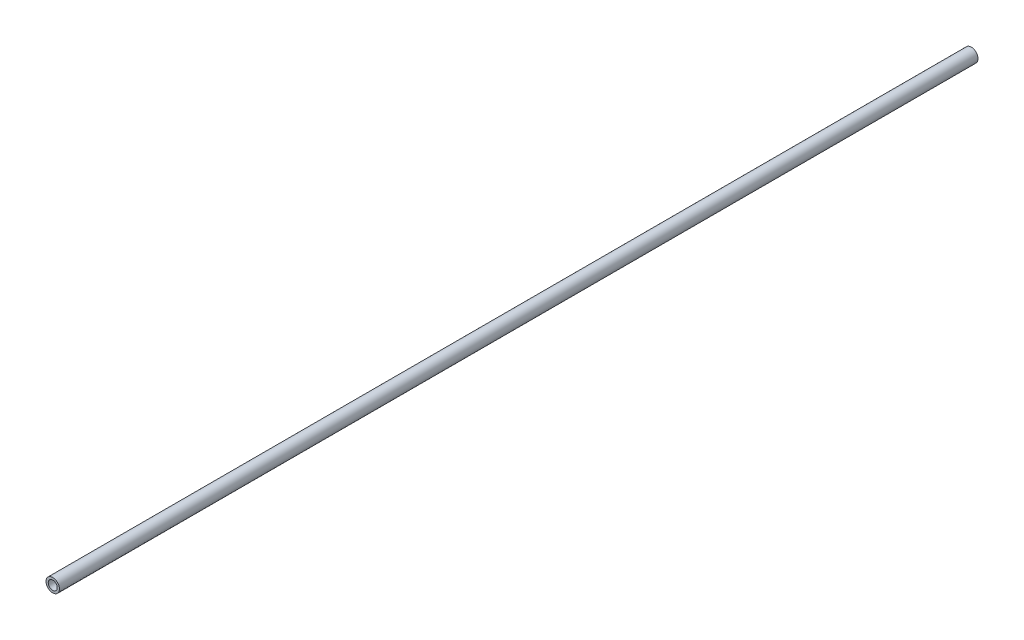
from build123d import *

# Parameters (mm, degrees)
SKETCH_1_R      = 3
SKETCH_1_R_2    = 2
EXTRUDE_1_DEPTH = 205


with BuildPart() as part:
    # Эскиз1 → Бобышка-Вытянуть1 (new, symmetric)
    with BuildSketch(Plane.XY):
        with Locations(Location((0, 0, 0), (0, 0, 180))):
            Circle(SKETCH_1_R)
        with Locations(Location((0, 0, 0), (0, 0, 180))):
            Circle(SKETCH_1_R_2, mode=Mode.SUBTRACT)
    extrude(amount=EXTRUDE_1_DEPTH, both=True)


solid = part.part
